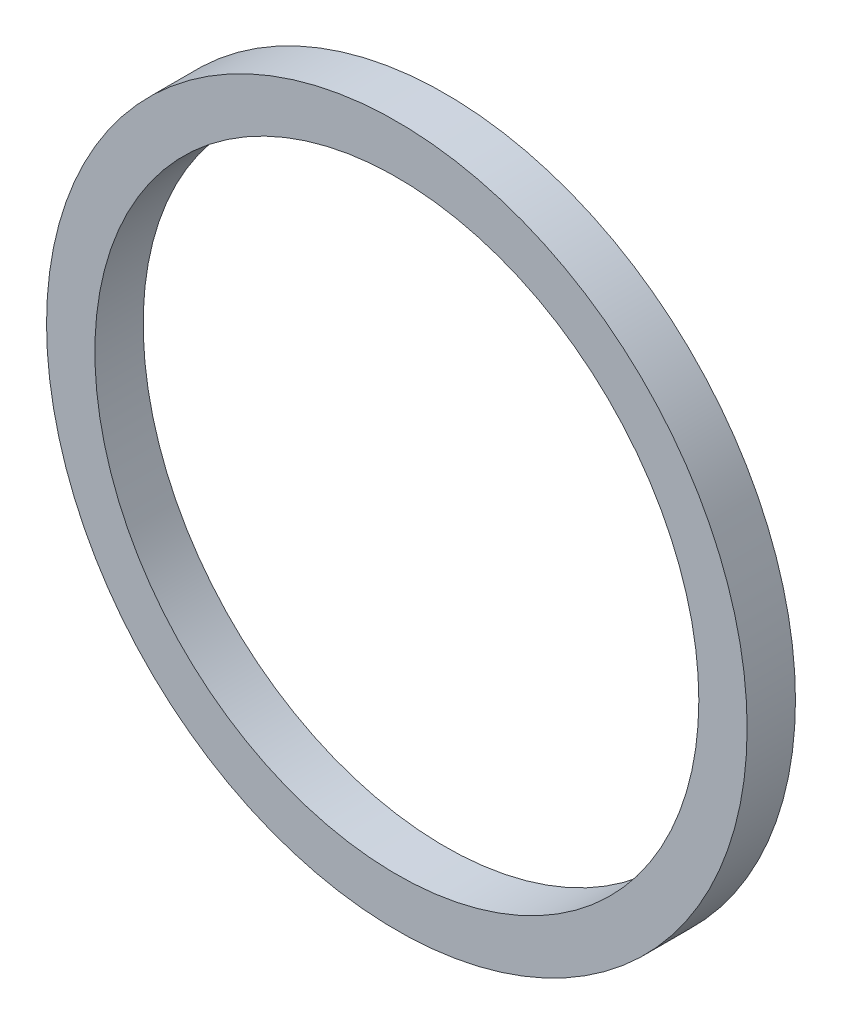
from build123d import *

# Parameters (mm, degrees)
SZKIC1_R                    = 72.5
SZKIC1_R_2                  = 62.5
DODANIE_WYCI_GNI_CIE1_DEPTH = 10


with BuildPart() as part:
    # Szkic1 → Dodanie-wyciągnięcie1 (new body)
    with BuildSketch(Plane.XY):
        Circle(SZKIC1_R)
        Circle(SZKIC1_R_2, mode=Mode.SUBTRACT)
    extrude(amount=DODANIE_WYCI_GNI_CIE1_DEPTH)


solid = part.part
